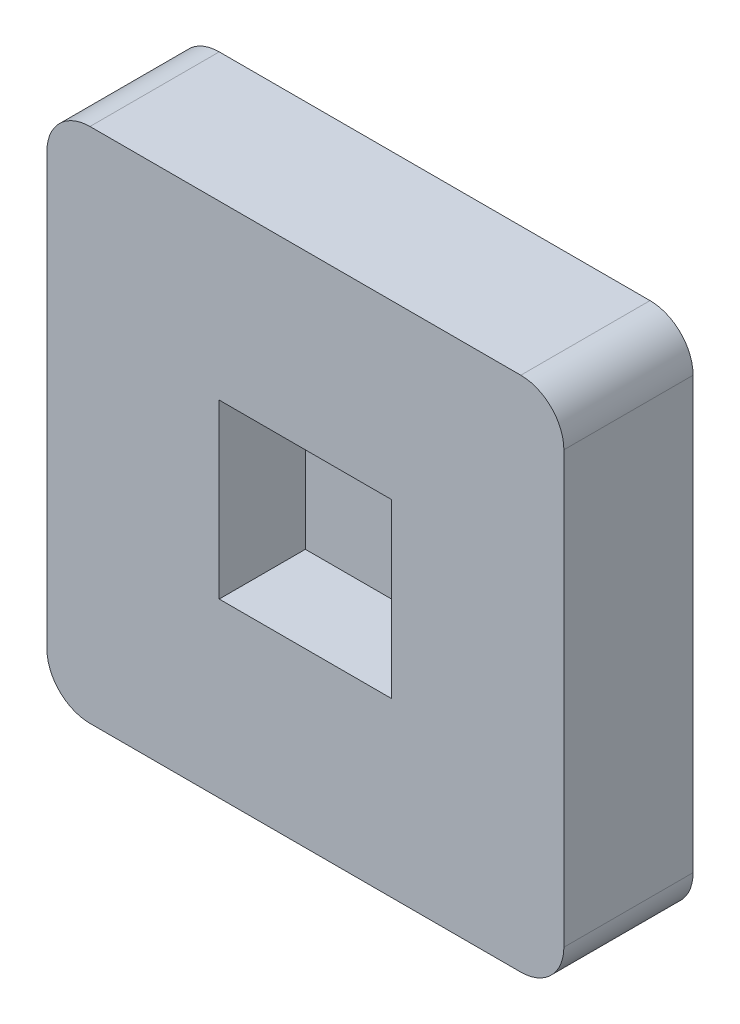
from build123d import *

# Parameters (mm, degrees)
SKETCH_1_W          = 12
SKETCH_1_H          = 12
EXTRUDE_1_DEPTH     = 3
SKETCH_2_W          = 4
SKETCH_2_H          = 4
CUT_EXTRUDE_1_DEPTH = 2
FILLET_1_R          = 1


with BuildPart() as part:
    # 스케치1 → 보스-돌출1 (new body)
    with BuildSketch(Plane.XY):
        Rectangle(SKETCH_1_W, SKETCH_1_H)
    extrude(amount=EXTRUDE_1_DEPTH)

    # 스케치2 → 컷-돌출1 (cut)
    with BuildSketch(Plane.XY.offset(3)):
        Rectangle(SKETCH_2_W, SKETCH_2_H)
    extrude(amount=-CUT_EXTRUDE_1_DEPTH, mode=Mode.SUBTRACT)

    # 필렛1
    fillet_1_edges = [part.edges().sort_by_distance(p)[0] for p in [
        (6, -6, 1.5),
        (-6, -6, 1.5),
        (-6, 6, 1.5),
        (6, 6, 1.5),
    ]]
    fillet(fillet_1_edges, radius=FILLET_1_R)


solid = part.part
